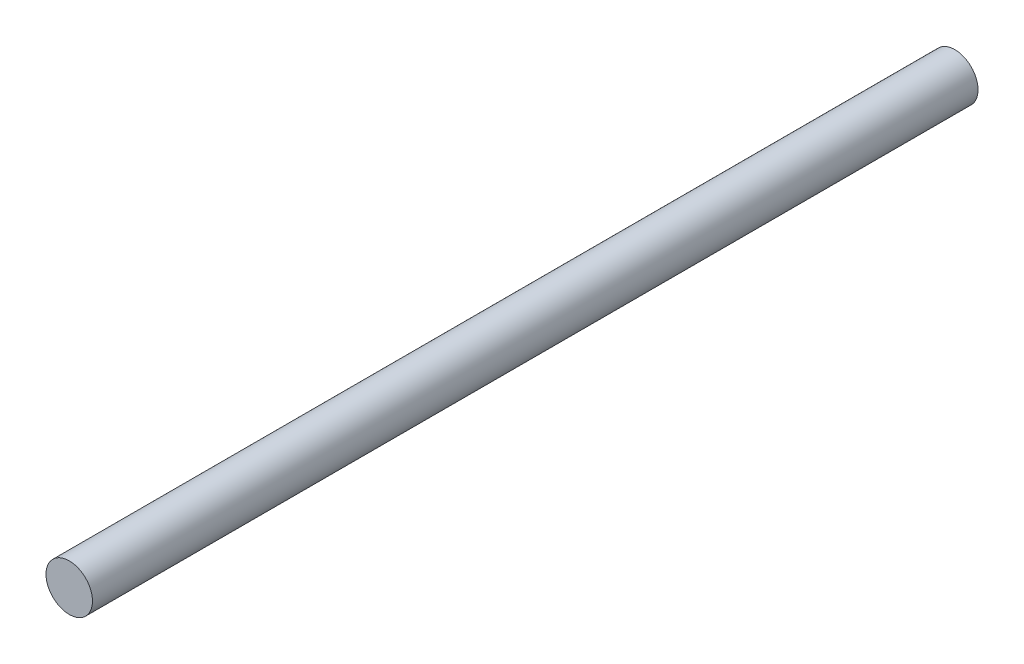
from build123d import *

# Parameters (mm, degrees)
SKETCH1_R           = 2
BOSS_EXTRUDE1_DEPTH = 38.1


with BuildPart() as part:
    # Sketch1 → Boss-Extrude1 (new, symmetric)
    with BuildSketch(Plane.XY):
        with Locations(Location((0, 0, 0), (0, 0, 180))):
            Circle(SKETCH1_R)
    extrude(amount=BOSS_EXTRUDE1_DEPTH, both=True)


solid = part.part
